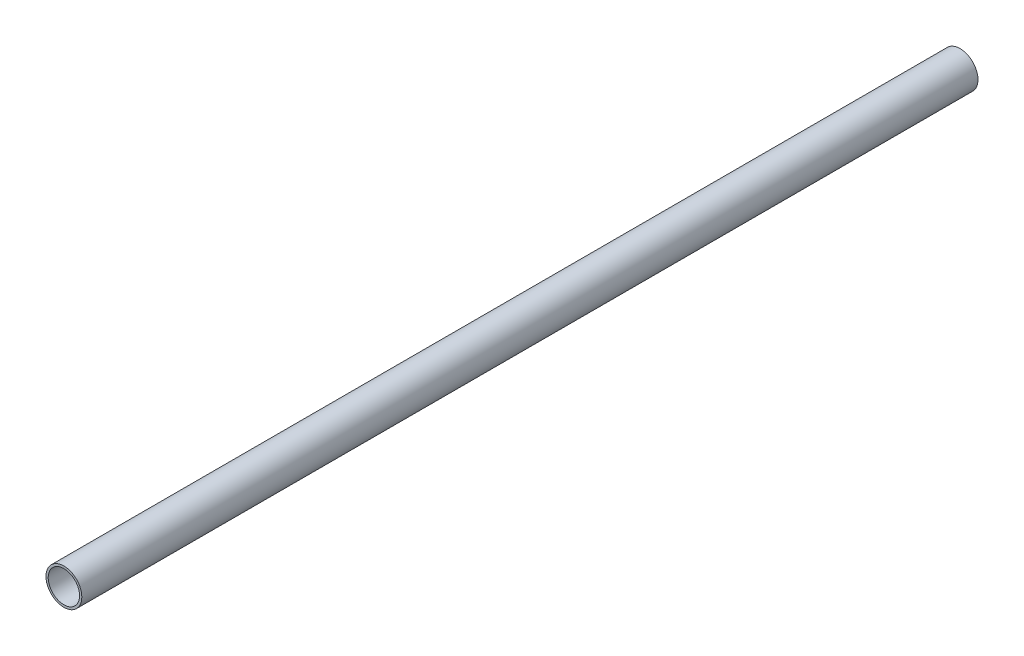
from build123d import *

# Parameters (mm, degrees)
CROQUIS1_R              = 8
CROQUIS1_R_2            = 7
SALIENTE_EXTRUIR1_DEPTH = 200


with BuildPart() as part:
    # Croquis1 → Saliente-Extruir1 (new, symmetric)
    with BuildSketch(Plane.XY):
        Circle(CROQUIS1_R)
        Circle(CROQUIS1_R_2, mode=Mode.SUBTRACT)
    extrude(amount=SALIENTE_EXTRUIR1_DEPTH, both=True)


solid = part.part
